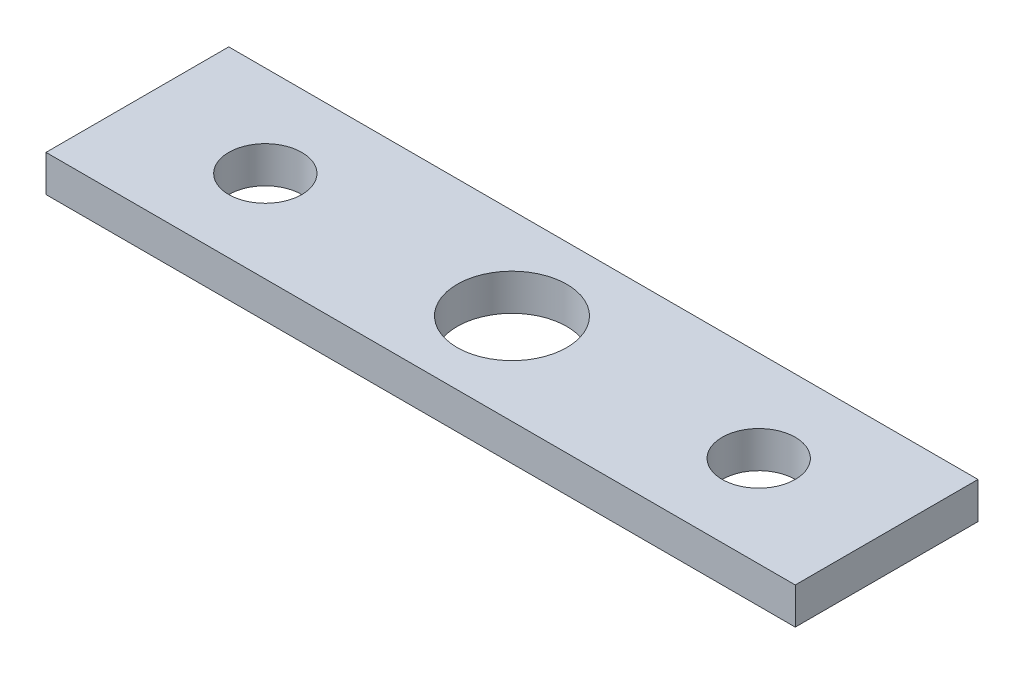
from build123d import *

# Parameters (mm, degrees)
SKETCH1_W           = 35
SKETCH1_H           = 10
SKETCH1_R           = 3
BOSS_EXTRUDE1_DEPTH = 2
SKETCH4_R           = 2
CUT_EXTRUDE2_DEPTH  = 20
SKETCH5_W           = 10
SKETCH5_H           = 2
BOSS_EXTRUDE3_DEPTH = 3
SKETCH6_W           = 10
SKETCH6_H           = 2
BOSS_EXTRUDE4_DEPTH = 3


with BuildPart() as part:
    # Sketch1 → Boss-Extrude1 (new body)
    with BuildSketch(Plane(origin=(0, 0, 0), x_dir=(1, 0, 0), z_dir=(0, 1, 0))):
        with Locations((17.5, 5)):
            Rectangle(SKETCH1_W, SKETCH1_H)
        with Locations(Location((17.5, 5, 0), (0, 0, 270))):
            Circle(SKETCH1_R, mode=Mode.SUBTRACT)
    extrude(amount=BOSS_EXTRUDE1_DEPTH)

    # Sketch4 → Cut-Extrude2 (cut)
    with BuildSketch(Plane.XZ):
        with Locations(Location((4, -5, 0), (0, 0, 270))):
            Circle(SKETCH4_R)
        with Locations(Location((31, -5, 0), (0, 0, 270))):
            Circle(SKETCH4_R)
    extrude(amount=-CUT_EXTRUDE2_DEPTH, mode=Mode.SUBTRACT)

    # Sketch5 → Boss-Extrude3 (add)
    with BuildSketch(Plane.ZY):
        with Locations((-5, 1)):
            Rectangle(SKETCH5_W, SKETCH5_H)
    extrude(amount=BOSS_EXTRUDE3_DEPTH)

    # Sketch6 → Boss-Extrude4 (add)
    with BuildSketch(Plane(origin=(35, 0, 0), x_dir=(0, 0, -1), z_dir=(1, 0, 0))):
        with Locations((5, 1)):
            Rectangle(SKETCH6_W, SKETCH6_H)
    extrude(amount=BOSS_EXTRUDE4_DEPTH)


solid = part.part
